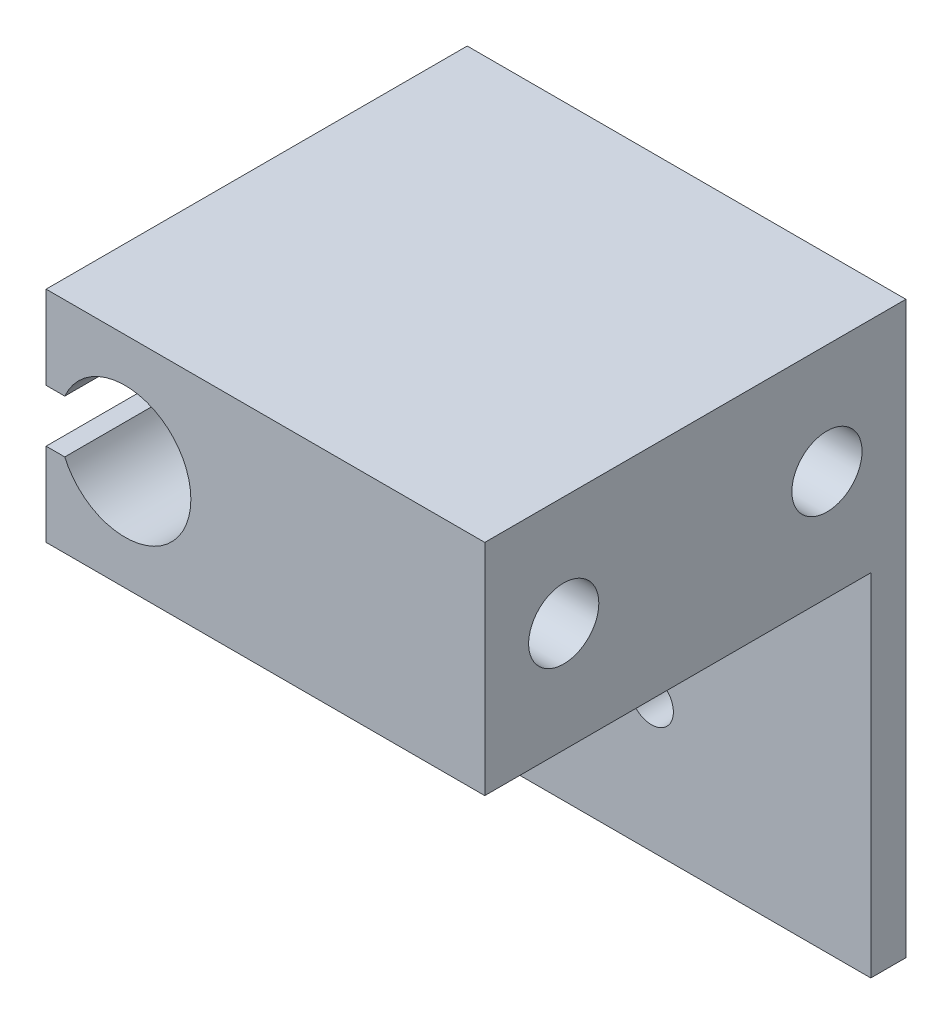
from build123d import *

# Parameters (mm, degrees)
BOSS_EXTRUDE1_DEPTH = 24
SKETCH2_R           = 4
CUT_EXTRUDE1_DEPTH  = 30
SKETCH5_W           = 50
SKETCH5_H           = 40
SKETCH5_R           = 2.5
BOSS_EXTRUDE3_DEPTH = 4


with BuildPart() as part:
    # Sketch1 → Boss-Extrude1 (new, symmetric)
    with BuildSketch(Plane.XY):
        with BuildLine():
            Line((-22.873863542, 3), (-25, 3))
            Line((-25, 3), (-25, 12.5))
            Line((-25, 12.5), (25, 12.5))
            Line((25, 12.5), (25, -12.5))
            Line((25, -12.5), (-25, -12.5))
            Line((-25, -12.5), (-25, -3))
            Line((-25, -3), (-22.873863542, -3))
            ThreePointArc((-22.873863542, -3), (-8.5, 0), (-22.873863542, 3))
        make_face()
    extrude(amount=BOSS_EXTRUDE1_DEPTH, both=True)

    # Sketch2 → Cut-Extrude1 (cut)
    with BuildSketch(Plane(origin=(25, 0, 0), x_dir=(0, 0, -1), z_dir=(1, 0, 0))):
        with Locations((-15, 0)):
            Circle(SKETCH2_R)
        with Locations((15, 0)):
            Circle(SKETCH2_R)
    extrude(amount=-CUT_EXTRUDE1_DEPTH, mode=Mode.SUBTRACT)

    # Sketch5 → Boss-Extrude3 (add)
    with BuildSketch(Plane(origin=(0, 0, -24), x_dir=(-1, 0, 0), z_dir=(0, 0, -1))):
        with Locations((0, -32.5)):
            Rectangle(SKETCH5_W, SKETCH5_H)
        with Locations((0, -37.5)):
            Circle(SKETCH5_R, mode=Mode.SUBTRACT)
    extrude(amount=-BOSS_EXTRUDE3_DEPTH)


solid = part.part
